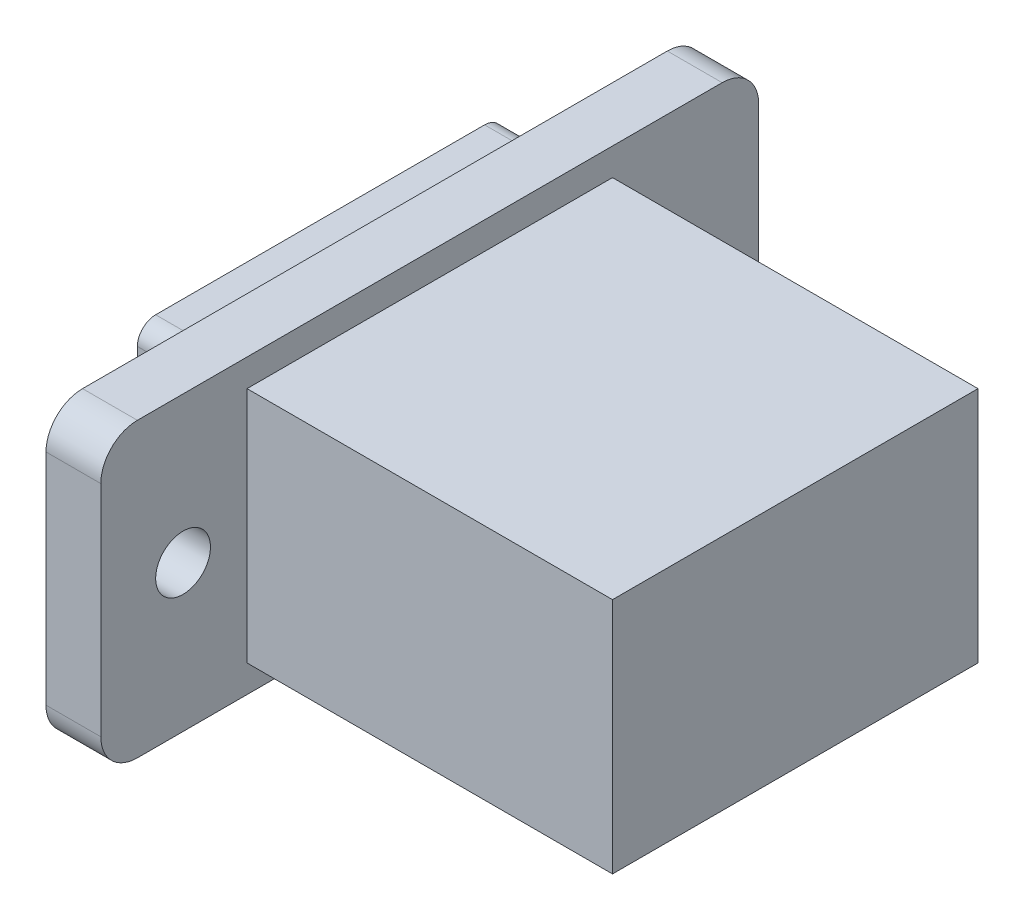
from build123d import *

# Parameters (mm, degrees)
SKETCH_1_W          = 36
SKETCH_1_H          = 16
EXTRUDE_1_DEPTH     = 3
SKETCH_2_W          = 20
SKETCH_2_H          = 13
EXTRUDE_2_DEPTH     = 3
SKETCH_3_W          = 20
SKETCH_3_H          = 13
EXTRUDE_3_DEPTH     = 20
FILLET_1_R          = 2
FILLET_2_R          = 1
SKETCH_4_R          = 1.5
CUT_EXTRUDE_1_DEPTH = 46.617978912


with BuildPart() as part:
    # 草图1 → 凸台-拉伸1 (new body)
    with BuildSketch(Plane(origin=(0, 0, 0), x_dir=(0, 0, -1), z_dir=(1, 0, 0))):
        with Locations((18, 8)):
            Rectangle(SKETCH_1_W, SKETCH_1_H)
    extrude(amount=EXTRUDE_1_DEPTH)

    # 草图2 → 凸台-拉伸2 (add)
    with BuildSketch(Plane.ZY):
        with Locations((-18, 8)):
            Rectangle(SKETCH_2_W, SKETCH_2_H)
    extrude(amount=EXTRUDE_2_DEPTH)

    # 草图3 → 凸台-拉伸3 (add)
    with BuildSketch(Plane(origin=(3, 0, 0), x_dir=(0, 0, -1), z_dir=(1, 0, 0))):
        with Locations((18, 8)):
            Rectangle(SKETCH_3_W, SKETCH_3_H)
    extrude(amount=EXTRUDE_3_DEPTH)

    # 圆角1
    fillet_1_edges = [part.edges().sort_by_distance(p)[0] for p in [
        (1.5, 16, 0),
        (1.5, 16, -36),
        (1.5, 0, -36),
        (1.5, 0, 0),
    ]]
    fillet(fillet_1_edges, radius=FILLET_1_R)

    # 圆角2
    fillet_2_edges = [part.edges().sort_by_distance(p)[0] for p in [
        (-1.5, 14.5, -28),
        (-1.5, 1.5, -28),
        (-1.5, 1.5, -8),
        (-1.5, 14.5, -8),
    ]]
    fillet(fillet_2_edges, radius=FILLET_2_R)

    # 草图4 → 切除-拉伸1 (cut, through all)
    with BuildSketch(Plane.ZY):
        with Locations((-31.5, 8)):
            Circle(SKETCH_4_R)
        with Locations((-4.5, 8)):
            Circle(SKETCH_4_R)
    extrude(amount=-CUT_EXTRUDE_1_DEPTH, mode=Mode.SUBTRACT)


solid = part.part
